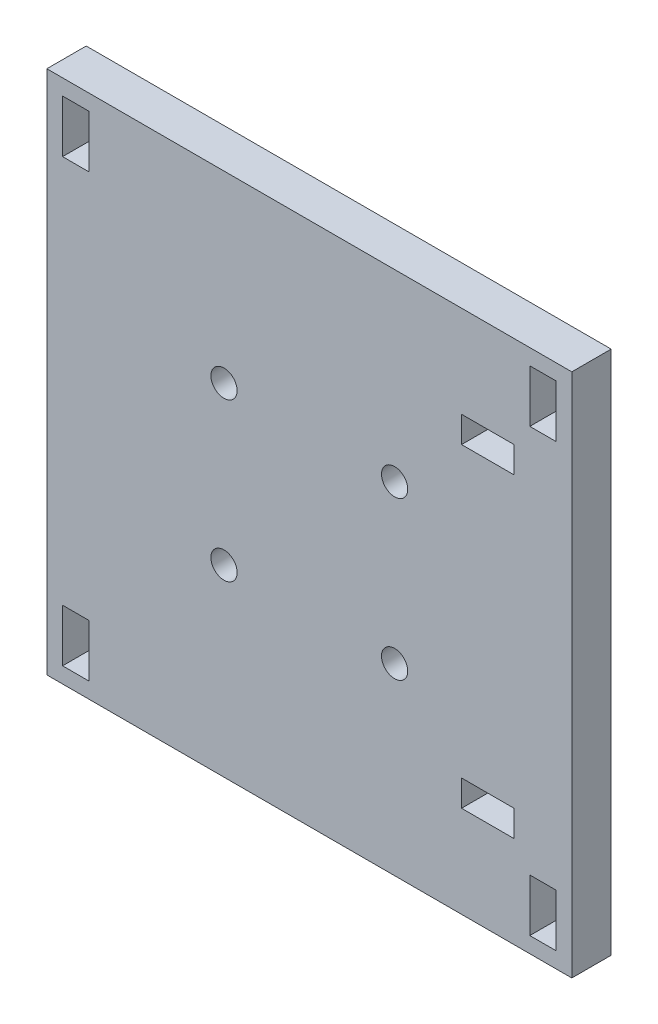
from build123d import *

# Parameters (mm, degrees)
SKETCH1_W           = 40
SKETCH1_H           = 40
SKETCH1_R           = 1
BOSS_EXTRUDE1_DEPTH = 3
SKETCH2_W           = 2
SKETCH2_H           = 4
SKETCH2_W_2         = 4
SKETCH2_H_2         = 2
CUT_EXTRUDE1_DEPTH  = 29.442925307


with BuildPart() as part:
    # Sketch1 → Boss-Extrude1 (new body)
    with BuildSketch(Plane.XY):
        Rectangle(SKETCH1_W, SKETCH1_H)
        with Locations((6.5, -6)):
            Circle(SKETCH1_R, mode=Mode.SUBTRACT)
        with Locations(Location((-6.5, -6, 0), (0, 0, 180))):
            Circle(SKETCH1_R, mode=Mode.SUBTRACT)
        with Locations(Location((6.5, 6, 0), (0, 0, 180))):
            Circle(SKETCH1_R, mode=Mode.SUBTRACT)
        with Locations((-6.5, 6)):
            Circle(SKETCH1_R, mode=Mode.SUBTRACT)
    extrude(amount=BOSS_EXTRUDE1_DEPTH)

    # Sketch2 → Cut-Extrude1 (cut, through all)
    with BuildSketch(Plane.XY.offset(3)):
        with Locations((17.8, 16.8)):
            Rectangle(SKETCH2_W, SKETCH2_H)
        with Locations((-17.8, 16.8)):
            Rectangle(SKETCH2_W, SKETCH2_H)
        with Locations((13.6, 12)):
            Rectangle(SKETCH2_W_2, SKETCH2_H_2)
        with Locations((17.8, -16.8)):
            Rectangle(SKETCH2_W, SKETCH2_H)
        with Locations((-17.8, -16.8)):
            Rectangle(SKETCH2_W, SKETCH2_H)
        with Locations((13.6, -12)):
            Rectangle(SKETCH2_W_2, SKETCH2_H_2)
    extrude(amount=-CUT_EXTRUDE1_DEPTH, mode=Mode.SUBTRACT)


solid = part.part
